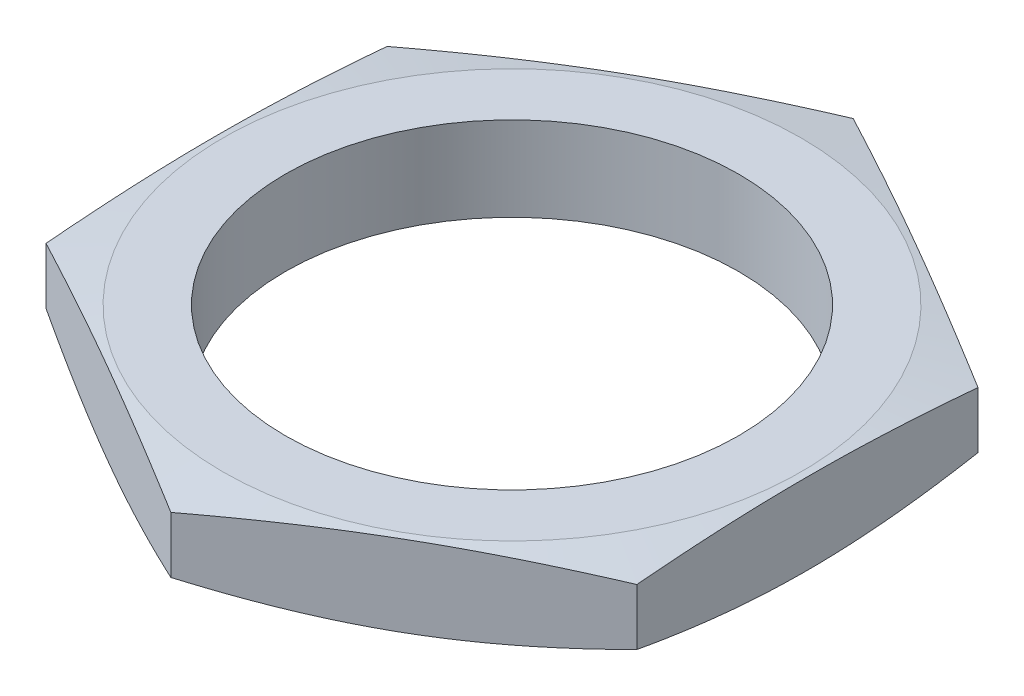
from build123d import *

# Parameters (mm, degrees)
SALIENTE_EXTRUIR1_DEPTH        = 2.7
CROQUIS2_OUTSIDE_W             = 57.324
CROQUIS2_OUTSIDE_H             = 60.248
CROQUIS2_OUTSIDE_R             = 9.25
CORTAR_EXTRUIR1_DEPTH          = 2.7
CORTAR_EXTRUIR1_DRAFT          = -80
CROQUIS3_OUTSIDE_W             = 41.536
CROQUIS3_OUTSIDE_H             = 44.46
CROQUIS3_OUTSIDE_R             = 9.25
CORTAR_EXTRUIR2_DEPTH          = 2.7
CORTAR_EXTRUIR2_DRAFT          = -70
TALADRO_ROSCADO_M16X1_51_D     = 14.5
TALADRO_ROSCADO_M16X1_51_DEPTH = 39.5
TALADRO_ROSCADO_M16X1_51_TIP   = 4.356239488


with BuildPart() as part:
    # Croquis1 → Saliente-Extruir1 (new body)
    with BuildSketch(Plane(origin=(0, 0, 0), x_dir=(1, 0, 0), z_dir=(0, 1, 0))):
        Polygon((0, -10.911920088), (9.45, -5.455960044), (9.45, 5.455960044), (0, 10.911920088), (-9.45, 5.455960044), (-9.45, -5.455960044), align=None)
    extrude(amount=SALIENTE_EXTRUIR1_DEPTH)


with BuildPart() as cortar_extruir1_tool:
    # Croquis2 outside → Cortar-Extruir1 (with draft: the straight prism first)
    with BuildSketch(Plane(origin=(0, 2.7, 0), x_dir=(1, 0, 0), z_dir=(0, 1, 0))):
        Rectangle(CROQUIS2_OUTSIDE_W, CROQUIS2_OUTSIDE_H)
        Circle(CROQUIS2_OUTSIDE_R, mode=Mode.SUBTRACT)
    extrude(amount=-CORTAR_EXTRUIR1_DEPTH)
    # Cortar-Extruir1: the draft: its side faces are tilted about the plane it starts from
    cortar_extruir1_sides = [cortar_extruir1_tool.faces().sort_by_distance(p)[0] for p in [
        (0, 1.35, 30.124),
        (28.662, 1.35, 0),
        (0, 1.35, -30.124),
        (-28.662, 1.35, 0),
        (-9.25, 1.35, 0),
    ]]
    draft(cortar_extruir1_sides, Plane(origin=(0, 2.7, 0), x_dir=(1, 0, 0), z_dir=(0, 1, 0)), CORTAR_EXTRUIR1_DRAFT)


with BuildPart() as part_1:
    add(part.part)

    # Cortar-Extruir1: cut by cortar_extruir1_tool
    add(cortar_extruir1_tool.part, mode=Mode.SUBTRACT)


with BuildPart() as cortar_extruir2_tool:
    # Croquis3 outside → Cortar-Extruir2 (with draft: the straight prism first)
    with BuildSketch(Plane(origin=(0, 0, 0), x_dir=(-1, 0, 0), z_dir=(0, -1, 0))):
        Rectangle(CROQUIS3_OUTSIDE_W, CROQUIS3_OUTSIDE_H)
        Circle(CROQUIS3_OUTSIDE_R, mode=Mode.SUBTRACT)
    extrude(amount=-CORTAR_EXTRUIR2_DEPTH)
    # Cortar-Extruir2: the draft: its side faces are tilted about the plane it starts from
    cortar_extruir2_sides = [cortar_extruir2_tool.faces().sort_by_distance(p)[0] for p in [
        (0, 1.35, 22.23),
        (-20.768, 1.35, 0),
        (0, 1.35, -22.23),
        (20.768, 1.35, 0),
        (9.25, 1.35, 0),
    ]]
    draft(cortar_extruir2_sides, Plane(origin=(0, 0, 0), x_dir=(-1, 0, 0), z_dir=(0, -1, 0)), CORTAR_EXTRUIR2_DRAFT)


with BuildPart() as part_2:
    add(part_1.part)

    # Cortar-Extruir2: cut by cortar_extruir2_tool
    add(cortar_extruir2_tool.part, mode=Mode.SUBTRACT)

    # Taladro roscado M16x1.51
    with Locations(Plane(origin=(0, 2.7, 0), x_dir=(1, 0, 0), z_dir=(0, 1, 0))):
        with Locations((0, 0)):
            Hole(TALADRO_ROSCADO_M16X1_51_D / 2, depth=TALADRO_ROSCADO_M16X1_51_DEPTH)
            with Locations((0, 0, -(TALADRO_ROSCADO_M16X1_51_DEPTH + TALADRO_ROSCADO_M16X1_51_TIP / 2))):  # 118° drill point
                Cone(0, TALADRO_ROSCADO_M16X1_51_D / 2, TALADRO_ROSCADO_M16X1_51_TIP, mode=Mode.SUBTRACT)


solid = part_2.part
